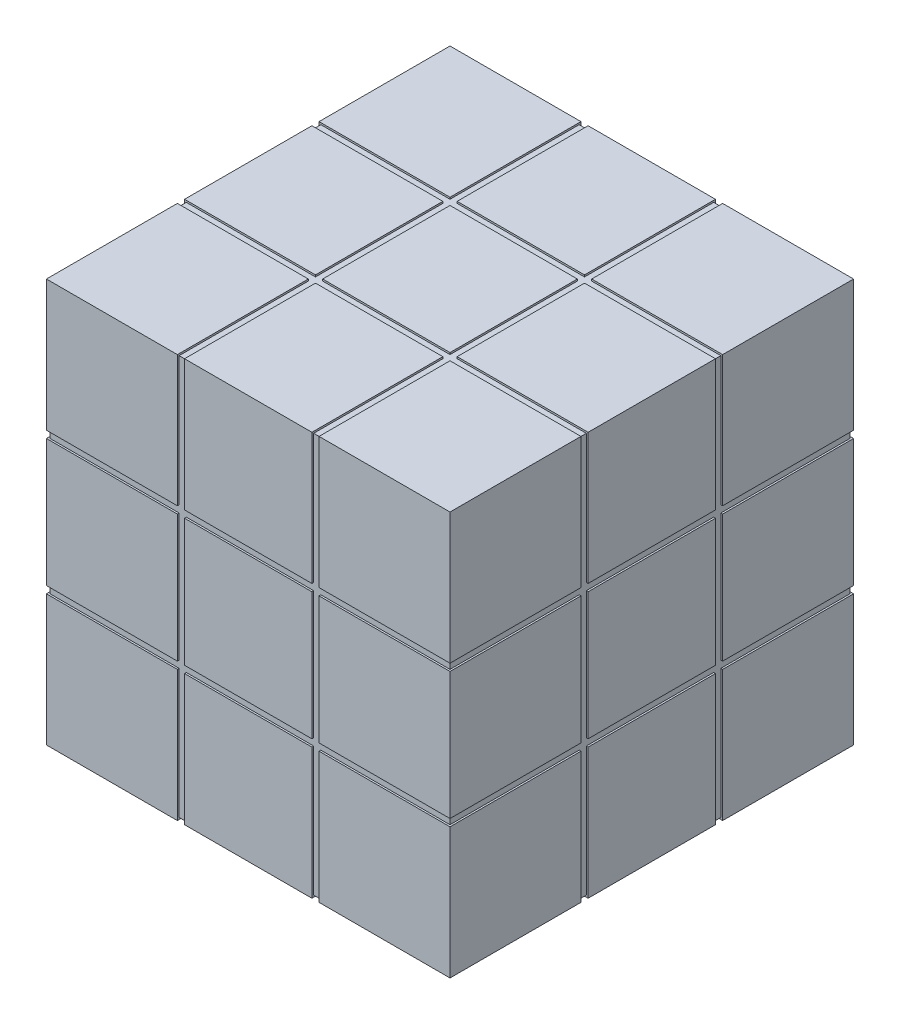
from build123d import *

# Parameters (mm, degrees)
ESQUISSE1_W                     = 57.3532
ESQUISSE1_H                     = 57.3532
BOSS_EXTRU_1_DEPTH              = 28.6766
ESQUISSE2_W                     = 1.016
ESQUISSE2_H                     = 57.3532
ESQUISSE2_W_2                   = 57.3532
ESQUISSE2_H_2                   = 1.016
ENL_V_DE_MAT_EXTRU_MINCE1_DEPTH = 0.254
ESQUISSE3_W                     = 1.016
ESQUISSE3_H                     = 57.3532
ESQUISSE3_W_2                   = 57.3532
ESQUISSE3_H_2                   = 1.016
ENL_V_DE_MAT_EXTRU_MINCE2_DEPTH = 0.254
ESQUISSE4_W                     = 1.016
ESQUISSE4_H                     = 57.3532
ESQUISSE4_W_2                   = 57.3532
ESQUISSE4_H_2                   = 1.016
ENL_V_DE_MAT_EXTRU_MINCE3_DEPTH = 0.254


with BuildPart() as part:
    # Esquisse1 → Boss.-Extru.1 (new, symmetric)
    with BuildSketch(Plane(origin=(0, 0, 0), x_dir=(1, 0, 0), z_dir=(0, 1, 0))):
        Rectangle(ESQUISSE1_W, ESQUISSE1_H)
    extrude(amount=BOSS_EXTRU_1_DEPTH, both=True)

    # Esquisse2 → Enlèv. de mat.-Extru.-Mince1 (cut)
    with BuildSketch(Plane(origin=(0, 28.6766, 0), x_dir=(1, 0, 0), z_dir=(0, 1, 0))):
        with Locations((-9.558866667, 0)):
            Rectangle(ESQUISSE2_W, ESQUISSE2_H)
        with Locations((9.558866667, 0)):
            Rectangle(ESQUISSE2_W, ESQUISSE2_H)
        with Locations((0, 9.558866667)):
            Rectangle(ESQUISSE2_W_2, ESQUISSE2_H_2)
        with Locations((0, -9.558866667)):
            Rectangle(ESQUISSE2_W_2, ESQUISSE2_H_2)
    enl_v_de_mat_extru_mince1 = extrude(amount=-ENL_V_DE_MAT_EXTRU_MINCE1_DEPTH, mode=Mode.SUBTRACT)

    # Esquisse3 → Enlèv. de mat.-Extru.-Mince2 (cut)
    with BuildSketch(Plane(origin=(28.6766, 0, 0), x_dir=(0, 0, -1), z_dir=(1, 0, 0))):
        with Locations((-9.558866667, 0)):
            Rectangle(ESQUISSE3_W, ESQUISSE3_H)
        with Locations((9.558866667, 0)):
            Rectangle(ESQUISSE3_W, ESQUISSE3_H)
        with Locations((0, -9.558866667)):
            Rectangle(ESQUISSE3_W_2, ESQUISSE3_H_2)
        with Locations((0, 9.558866667)):
            Rectangle(ESQUISSE3_W_2, ESQUISSE3_H_2)
    enl_v_de_mat_extru_mince2 = extrude(amount=-ENL_V_DE_MAT_EXTRU_MINCE2_DEPTH, mode=Mode.SUBTRACT)

    # Esquisse4 → Enlèv. de mat.-Extru.-Mince3 (cut)
    with BuildSketch(Plane(origin=(0, 0, -28.6766), x_dir=(-1, 0, 0), z_dir=(0, 0, -1))):
        with Locations((-9.558866667, 0)):
            Rectangle(ESQUISSE4_W, ESQUISSE4_H)
        with Locations((9.558866667, 0)):
            Rectangle(ESQUISSE4_W, ESQUISSE4_H)
        with Locations((0, 9.558866667)):
            Rectangle(ESQUISSE4_W_2, ESQUISSE4_H_2)
        with Locations((0, -9.558866667)):
            Rectangle(ESQUISSE4_W_2, ESQUISSE4_H_2)
    enl_v_de_mat_extru_mince3 = extrude(amount=-ENL_V_DE_MAT_EXTRU_MINCE3_DEPTH, mode=Mode.SUBTRACT)

    # Symétrie1: Enlèv. de mat.-Extru.-Mince3 across plane
    add(enl_v_de_mat_extru_mince3.mirror(Plane.XY), mode=Mode.SUBTRACT)

    # Symétrie2: Enlèv. de mat.-Extru.-Mince1 across plane
    add(enl_v_de_mat_extru_mince1.mirror(Plane.ZX), mode=Mode.SUBTRACT)

    # Symétrie3: Enlèv. de mat.-Extru.-Mince2 across plane
    add(enl_v_de_mat_extru_mince2.mirror(Plane(origin=(0, 0, 0), x_dir=(0, 0, 1), z_dir=(1, 0, 0))), mode=Mode.SUBTRACT)


solid = part.part
